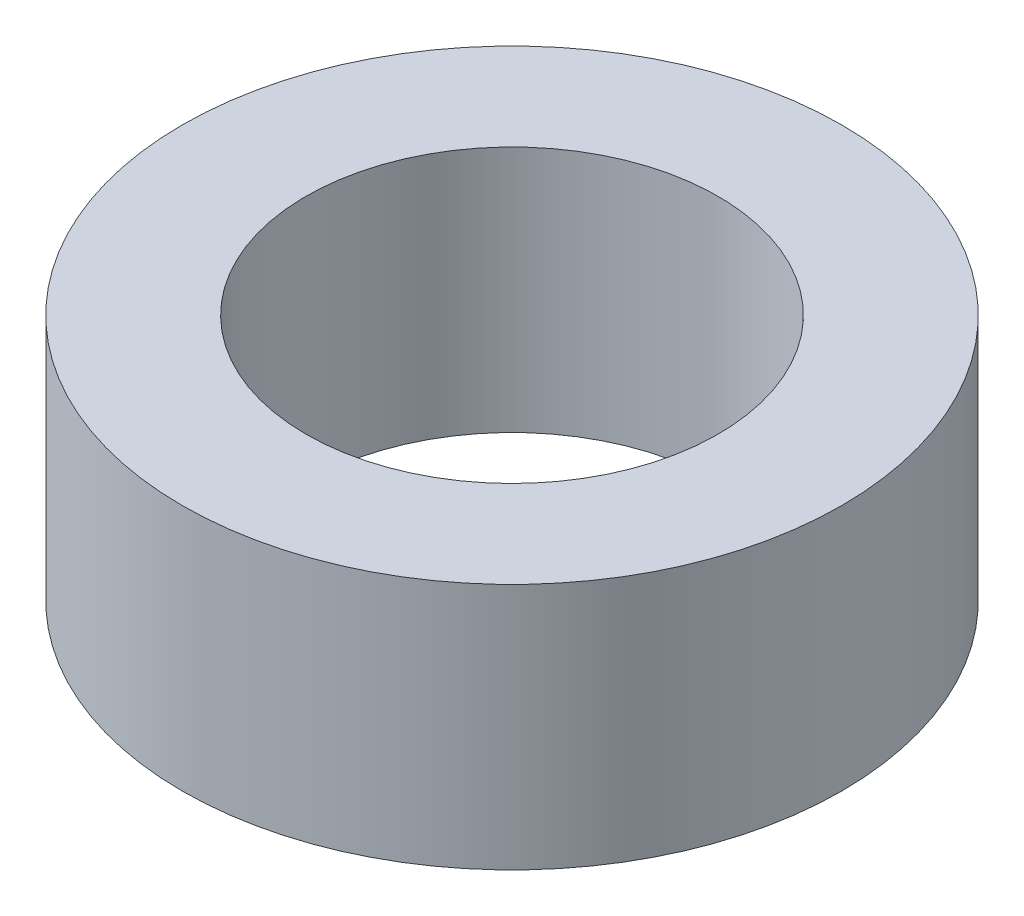
from build123d import *

# Parameters (mm, degrees)
SKETCH_1_R      = 4
SKETCH_1_R_2    = 2.5
EXTRUDE_1_DEPTH = 3


with BuildPart() as part:
    # 草图1 → 凸台-拉伸1 (new body)
    with BuildSketch(Plane(origin=(0, 0, 0), x_dir=(1, 0, 0), z_dir=(0, 1, 0))):
        with Locations(Location((0, 0, 0), (0, 0, 270))):
            Circle(SKETCH_1_R)
        with Locations(Location((0, 0, 0), (0, 0, 270))):
            Circle(SKETCH_1_R_2, mode=Mode.SUBTRACT)
    extrude(amount=EXTRUDE_1_DEPTH)


solid = part.part
